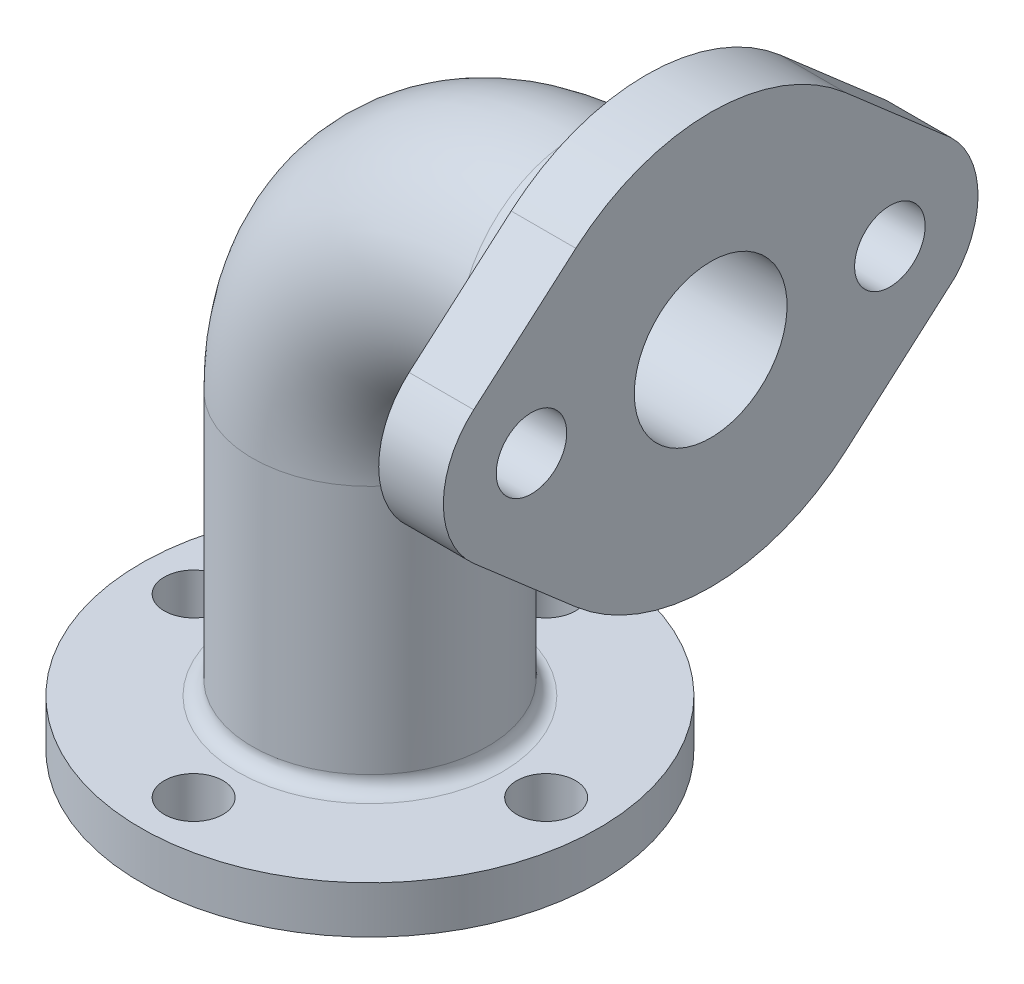
from build123d import *

# Parameters (mm, degrees)
BARRER_L_MINA1_PROFILE_R   = 20
BARRER_L_MINA1_PROFILE_R_2 = 13
CROQUIS166_R               = 6
CROQUIS166_R_2             = 20
SALIENTE_EXTRUIR2_DEPTH    = 11
SALIENTE_EXTRUIR3_START    = -8
CROQUIS167_R               = 39
CROQUIS167_R_2             = 13
SALIENTE_EXTRUIR3_DEPTH    = 8
CROQUIS168_R               = 5
CORTAR_EXTRUIR2_DEPTH      = 15
REDONDEO1_R                = 2.5
REDONDEO2_R                = 2.5


with BuildPart() as part:
    # Barrer-Lámina1: sweep along a path in Croquis8
    with BuildLine(Plane.XY) as barrer_l_mina1_path:
        Line((0, 0), (0, 53))
        ThreePointArc((0, 53), (10.251262658, 77.748737342), (35, 88))
        Line((35, 88), (58, 88))
    # Barrer-Lámina1 profile (on start of the path) → Barrer-Lámina1 (sweep)
    with BuildSketch(Plane.ZX):
        Circle(BARRER_L_MINA1_PROFILE_R)
        Circle(BARRER_L_MINA1_PROFILE_R_2, mode=Mode.SUBTRACT)
    sweep(path=barrer_l_mina1_path.line)

    # Croquis166 → Saliente-Extruir2 (add)
    with BuildSketch(Plane(origin=(58, 0, 0), x_dir=(0, 0, -1), z_dir=(1, 0, 0))):
        with BuildLine():
            Line((-40.336065574, 99.324831744), (-22.950819672, 114.424607403))
            ThreePointArc((-22.950819672, 114.424607403), (0.012124177, 122.9999979), (22.969121399, 114.408700501))
            Line((22.969121399, 114.408700501), (40.855221071, 98.852160917))
            ThreePointArc((40.855221071, 98.852160917), (45.491803378, 88.495813939), (41.549621493, 77.8557472))
            Line((41.549621493, 77.8557472), (23.053076053, 61.664554599))
            ThreePointArc((23.053076053, 61.664554599), (0.067834781, 53.000065737), (-22.950819672, 61.575392597))
            Line((-22.950819672, 61.575392597), (-40.336065574, 76.675168256))
            ThreePointArc((-40.336065574, 76.675168256), (-45.5, 88), (-40.336065574, 99.324831744))
        make_face()
        with Locations((-30.5, 88)):
            Circle(CROQUIS166_R, mode=Mode.SUBTRACT)
        with Locations((30.5, 88)):
            Circle(CROQUIS166_R, mode=Mode.SUBTRACT)
        with Locations((0, 88)):
            Circle(CROQUIS166_R_2, mode=Mode.SUBTRACT)
    extrude(amount=-SALIENTE_EXTRUIR2_DEPTH)

    # Croquis167 → Saliente-Extruir3 (add)
    with BuildSketch(Plane.XZ.offset(SALIENTE_EXTRUIR3_START)):
        with Locations(Location((0, 0, 0), (0, 0, 270))):
            Circle(CROQUIS167_R)
        with Locations(Location((0, 0, 0), (0, 0, 180))):
            Circle(CROQUIS167_R_2, mode=Mode.SUBTRACT)
    extrude(amount=SALIENTE_EXTRUIR3_DEPTH)

    # Croquis168 → Cortar-Extruir2 (cut)
    with BuildSketch(Plane.XZ):
        with Locations(Location((0, 30, 0), (0, 0, 270))):
            Circle(CROQUIS168_R)
        with Locations(Location((0, -30, 0), (0, 0, 270))):
            Circle(CROQUIS168_R)
        with Locations(Location((30, 0, 0), (0, 0, 270))):
            Circle(CROQUIS168_R)
        with Locations(Location((-30, 0, 0), (0, 0, 270))):
            Circle(CROQUIS168_R)
    extrude(amount=-CORTAR_EXTRUIR2_DEPTH, mode=Mode.SUBTRACT)

    # Redondeo1
    redondeo1_edges = [part.edges().sort_by_distance(p)[0] for p in [
        (47, 88, -20),
    ]]
    fillet(redondeo1_edges, radius=REDONDEO1_R)

    # Redondeo2
    redondeo2_edges = [part.edges().sort_by_distance(p)[0] for p in [
        (0, 8, -20),
    ]]
    fillet(redondeo2_edges, radius=REDONDEO2_R)


solid = part.part
